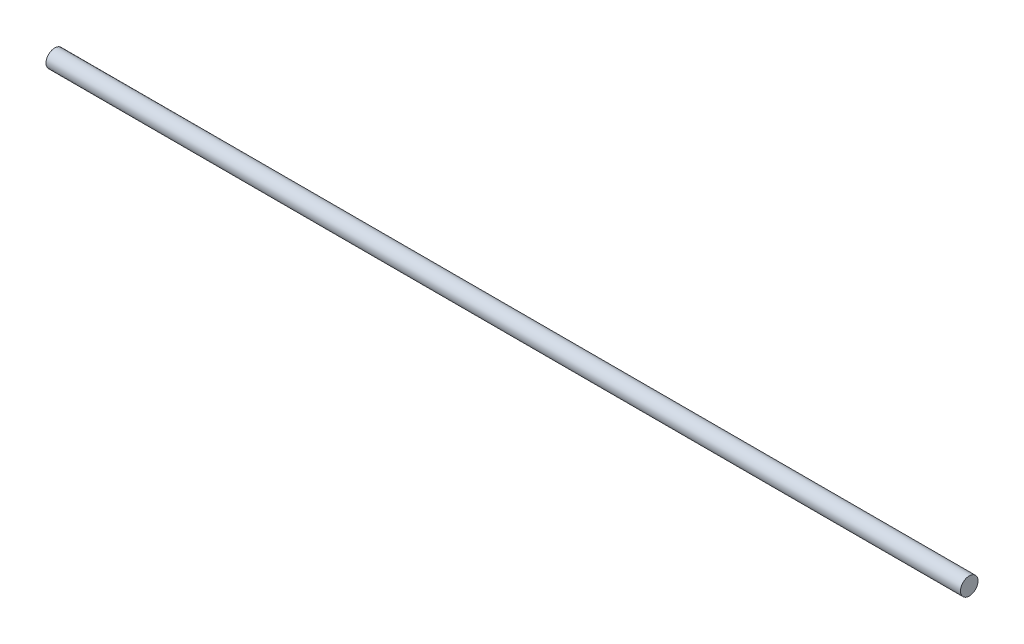
from build123d import *

# Parameters (mm, degrees)
SKETCH1_R           = 1.5
BOSS_EXTRUDE1_DEPTH = 156.49


with BuildPart() as part:
    # Sketch1 → Boss-Extrude1 (new body)
    with BuildSketch(Plane(origin=(0, 0, 0), x_dir=(0, 0, -1), z_dir=(1, 0, 0))):
        with Locations(Location((0, 0, 0), (0, 0, 180))):
            Circle(SKETCH1_R)
    extrude(amount=BOSS_EXTRUDE1_DEPTH)


solid = part.part
